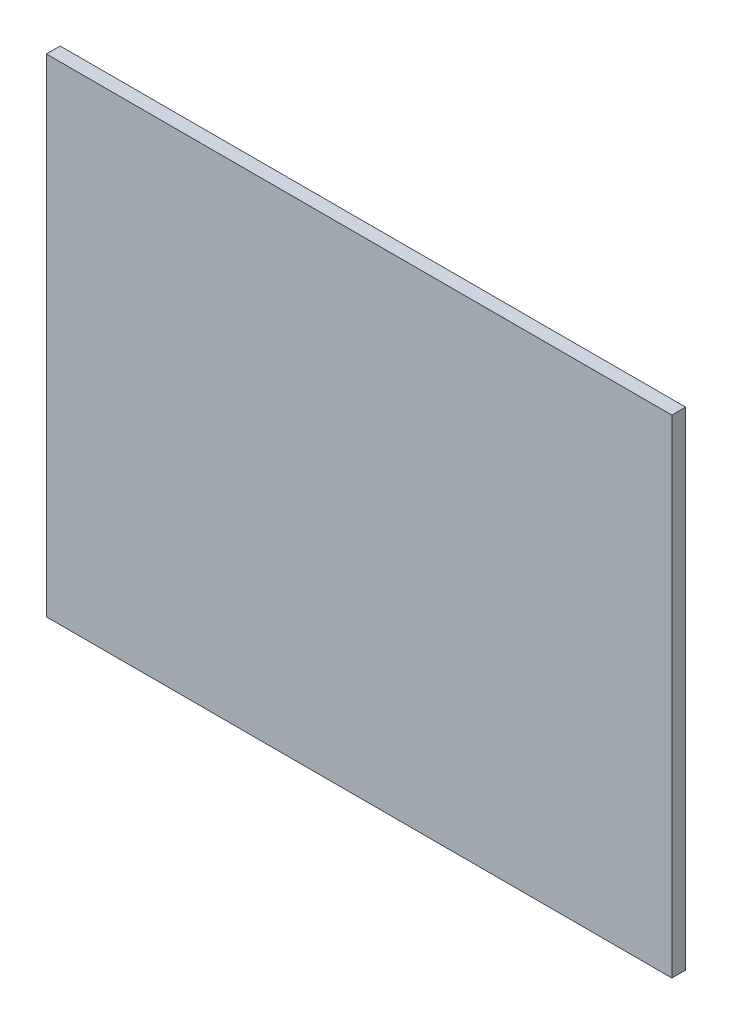
from build123d import *

# Parameters (mm, degrees)
SKETCH1_W           = 68
SKETCH1_H           = 53
BOSS_EXTRUDE1_DEPTH = 1.5


with BuildPart() as part:
    # Sketch1 → Boss-Extrude1 (new body)
    with BuildSketch(Plane.XY):
        Rectangle(SKETCH1_W, SKETCH1_H)
    extrude(amount=BOSS_EXTRUDE1_DEPTH)


solid = part.part
